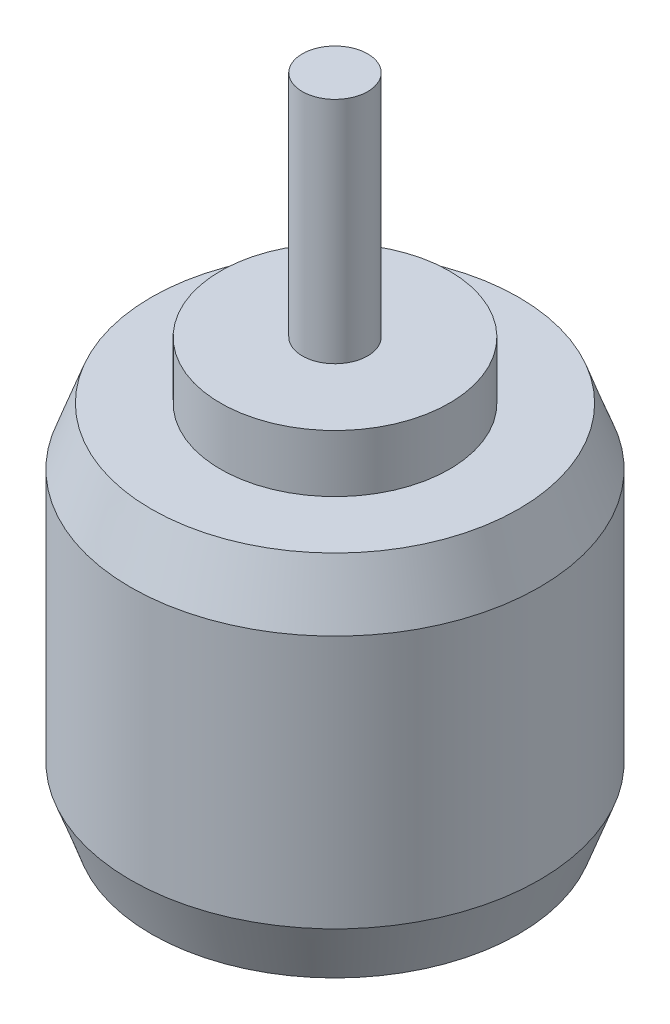
from build123d import *

# Parameters (mm, degrees)
SKETCH1_W          = 3
SKETCH1_H          = 2
SKETCH1_W_2        = 4
SKETCH1_H_2        = 7
SKETCH1_W_3        = 10
SKETCH1_H_3        = 28
CHAMFER1_SIZE      = 7
CHAMFER1_SIZE2     = 2.54779164
CHAMFER2_SIZE      = 7
CHAMFER2_SIZE2     = 2.54779164
SKETCH2_R          = 1.75
CUT_EXTRUDE1_DEPTH = 10


with BuildPart() as part:
    # Sketch1 → Revolve1 (revolve)
    with BuildSketch(Plane.XY, mode=Mode.PRIVATE) as revolve1_sk:
        Polygon((0, 45), (0, 0), (3, 0), (25, 0), (25, 45), (14, 45), (4, 45), align=None)
        with Locations((1.5, -1)):
            Rectangle(SKETCH1_W, SKETCH1_H)
        with Locations((2, 48.5)):
            Rectangle(SKETCH1_W_2, SKETCH1_H_2)
        with Locations((9, 48.5)):
            Rectangle(SKETCH1_W_3, SKETCH1_H_2)
        with Locations((2, 66)):
            Rectangle(SKETCH1_W_2, SKETCH1_H_3)
    revolve(revolve1_sk.sketch.rotate(Axis((0, 45, 0), (0, 1, 0)), 90), axis=Axis((0, 45, 0), (0, 1, 0)))

    # Chamfer1
    chamfer1_edges = [part.edges().sort_by_distance(p)[0] for p in [
        (0, 0, 25),
    ]]
    chamfer1_side = [part.faces().sort_by_distance(p)[0] for p in [
        (0, 22.5, 25),
    ]]
    chamfer(chamfer1_edges, length=CHAMFER1_SIZE, length2=CHAMFER1_SIZE2, reference=chamfer1_side[0])

    # Chamfer2
    chamfer2_edges = [part.edges().sort_by_distance(p)[0] for p in [
        (0, 45, 25),
    ]]
    chamfer2_side = [part.faces().sort_by_distance(p)[0] for p in [
        (0, 26, 25),
    ]]
    chamfer(chamfer2_edges, length=CHAMFER2_SIZE, length2=CHAMFER2_SIZE2, reference=chamfer2_side[0])

    # Sketch2 → Cut-Extrude1 (cut)
    with BuildSketch(Plane.XZ):
        with Locations((0, 10)):
            Circle(SKETCH2_R)
        with Locations((10, 0)):
            Circle(SKETCH2_R)
        with Locations((0, -10)):
            Circle(SKETCH2_R)
        with Locations((-10, 0)):
            Circle(SKETCH2_R)
    extrude(amount=-CUT_EXTRUDE1_DEPTH, mode=Mode.SUBTRACT)


solid = part.part
